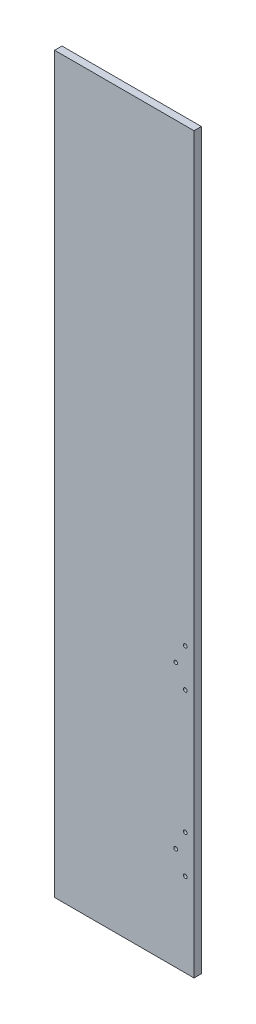
from build123d import *

# Parameters (mm, degrees)
SKETCH1_W           = 190
SKETCH1_H           = 1000
BOSS_EXTRUDE1_DEPTH = 10
SKETCH2_R           = 2.5
CUT_EXTRUDE1_DEPTH  = 510.043220169


with BuildPart() as part:
    # Sketch1 → Boss-Extrude1 (new body)
    with BuildSketch(Plane.XY):
        Rectangle(SKETCH1_W, SKETCH1_H)
    extrude(amount=BOSS_EXTRUDE1_DEPTH)

    # Sketch2 → Cut-Extrude1 (cut, through all)
    with BuildSketch(Plane.XY.offset(10)):
        with Locations((83, -386)):
            Circle(SKETCH2_R)
        with Locations((70, -360)):
            Circle(SKETCH2_R)
        with Locations((83, -334)):
            Circle(SKETCH2_R)
        with Locations((83, -166)):
            Circle(SKETCH2_R)
        with Locations((70, -140)):
            Circle(SKETCH2_R)
        with Locations((83, -114)):
            Circle(SKETCH2_R)
    extrude(amount=-CUT_EXTRUDE1_DEPTH, mode=Mode.SUBTRACT)


solid = part.part
